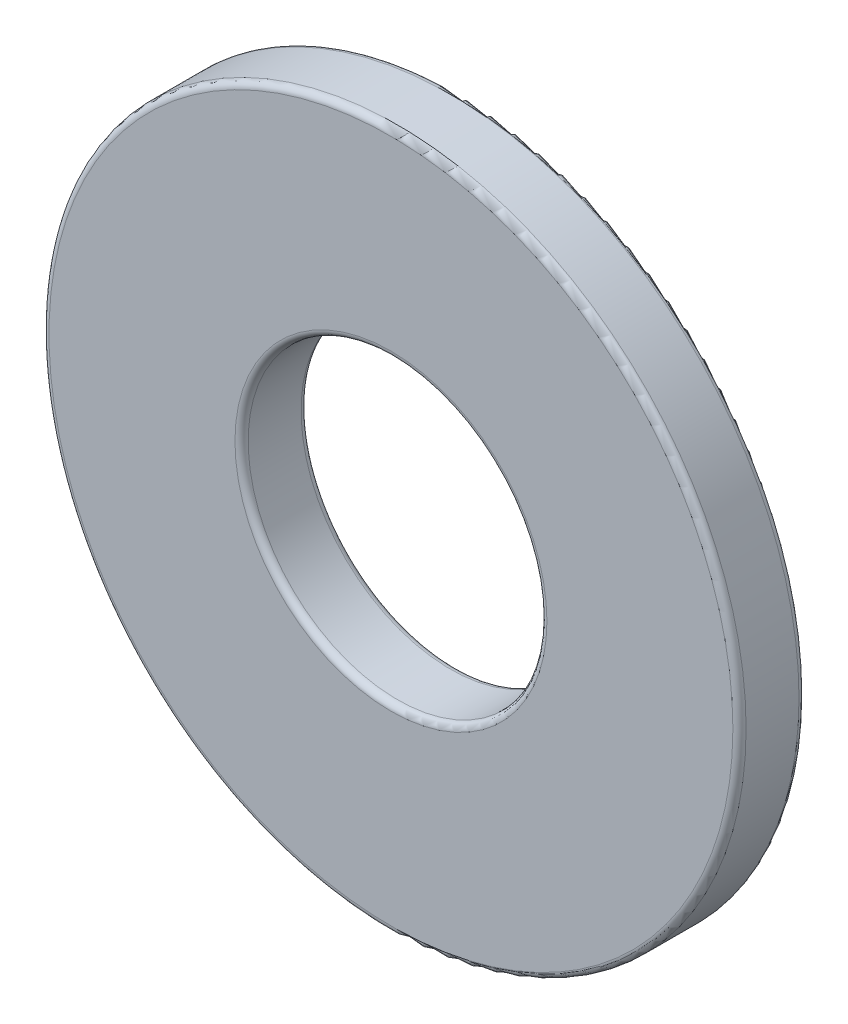
from build123d import *

# Parameters (mm, degrees)
BOSS_EXTRUDE1_DEPTH      = 1.0541
BOSS_EXTRUDE1_DEPTH_BACK = 1.0541
SKETCH3_R                = 11.1125
SKETCH3_R_2              = 4.7625
FILLET1_R                = 0.21082


with BuildPart() as part:
    # Sketch3 → Boss-Extrude1 (new, two sides: drawn at the far end of the back side and taken through both)
    with BuildSketch(Plane.XY.offset(-BOSS_EXTRUDE1_DEPTH_BACK)):
        Circle(SKETCH3_R)
        Circle(SKETCH3_R_2, mode=Mode.SUBTRACT)
    extrude(amount=BOSS_EXTRUDE1_DEPTH + BOSS_EXTRUDE1_DEPTH_BACK)

    # Fillet1
    fillet1_edges = [part.edges().sort_by_distance(p)[0] for p in [
        (-11.1125, 0, -1.0541),
        (-4.7625, 0, -1.0541),
        (-11.1125, 0, 1.0541),
        (-4.7625, 0, 1.0541),
    ]]
    fillet(fillet1_edges, radius=FILLET1_R)


solid = part.part
